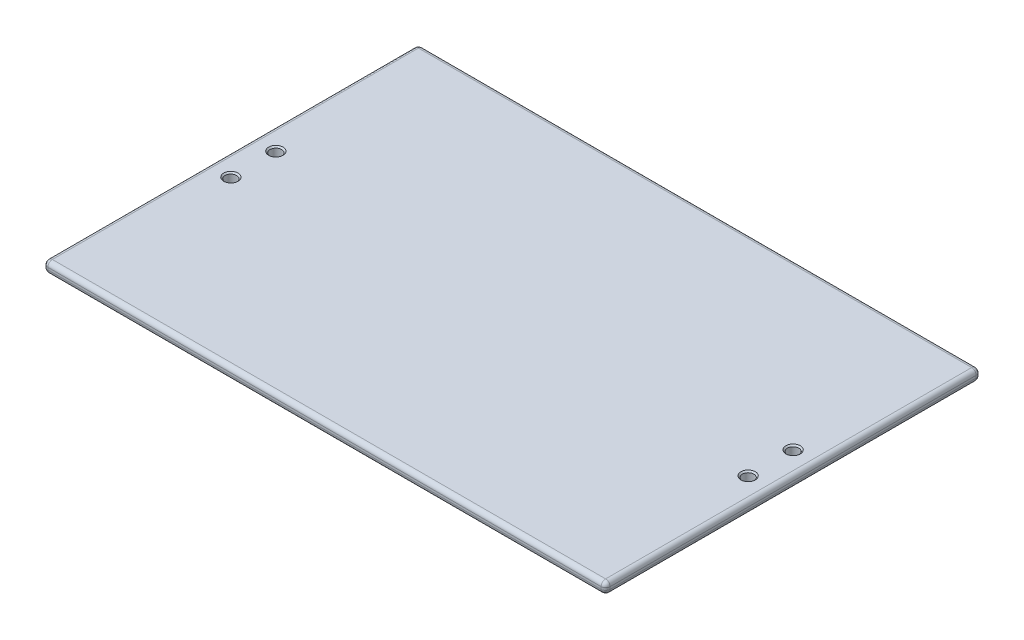
from build123d import *

# Parameters (mm, degrees)
SKETCH_1_W                     = 40
SKETCH_1_H                     = 66.7
EXTRUDE_1_DEPTH                = 2
SKETCH_2_W                     = 4
SKETCH_2_H                     = 66.7
EXTRUDE_2_DEPTH                = 100
CUT_EXTRUDE_1_DEPTH            = 115.526077816
CUT_EXTRUDE_1_DEPTH_BACK       = 115.526077816
HOLE_WIZARD_M4_1_D             = 3.3
HOLE_WIZARD_M4_1_CSINK_D       = 4.05
HOLE_WIZARD_M4_1_CSINK_ANGLE   = 90
HOLE_WIZARD_M4_2_AT_2_COUNT    = 2
HOLE_WIZARD_M4_2_AT_2_PITCH    = 68.59294731
HOLE_WIZARD_M4_2_AT_3_COUNT    = 2
HOLE_WIZARD_M4_2_AT_3_PITCH    = 26
HOLE_WIZARD_M4_2_AT_4_COUNT    = 2
HOLE_WIZARD_M4_2_AT_4_PITCH    = 62.376998966
HOLE_WIZARD_M4_2_AT_5_COUNT    = 2
HOLE_WIZARD_M4_2_AT_5_PITCH    = 56.7
SKETCH_11_W                    = 66.7
SKETCH_11_H                    = 2
EXTRUDE_3_DEPTH                = 100
SKETCH_13_W                    = 40
SKETCH_13_H                    = 66.7
EXTRUDE_4_DEPTH                = 2
SKETCH_14_W                    = 4
SKETCH_14_H                    = 66.7
EXTRUDE_5_DEPTH                = 100
CUT_EXTRUDE_2_DEPTH            = 180.589037806
CUT_EXTRUDE_2_DEPTH_BACK       = 180.589037806
HOLE_WIZARD_M4_3_AT_2_COUNT    = 2
HOLE_WIZARD_M4_3_AT_2_PITCH    = 26
HOLE_WIZARD_M4_3_AT_3_COUNT    = 2
HOLE_WIZARD_M4_3_AT_3_PITCH    = 62.376998966
HOLE_WIZARD_M4_3_AT_4_COUNT    = 2
HOLE_WIZARD_M4_3_AT_4_PITCH    = 56.7
CUT_EXTRUDE_3_REACH            = 181.589
SKETCH_18_R                    = 9.5
CUT_EXTRUDE_4_REACH            = 181.589
SKETCH_21_R                    = 11
CUT_EXTRUDE_5_REACH            = 181.589
SKETCH_22_R                    = 4.5
FILLET_1_R                     = 2
CUT_EXTRUDE_6_REACH            = 193.604
SKETCH_23_W                    = 36
SKETCH_23_H                    = 66.7
CUT_EXTRUDE_7_REACH            = 164.752
SKETCH_24_W                    = 36
SKETCH_24_H                    = 66.7
HOLE_WIZARD_M3_1_D             = 2.5
HOLE_WIZARD_M3_1_CSINK_D       = 3.05
HOLE_WIZARD_M3_1_CSINK_ANGLE   = 90
CUT_EXTRUDE_8_DEPTH            = 154.990981879
CUT_EXTRUDE_8_DEPTH_BACK       = 154.990981879
SKETCH_27_W                    = 4
SKETCH_27_H                    = 66.7
HOLE_WIZARD_M2_5_1_D           = 2.05
HOLE_WIZARD_M2_5_1_CSINK_D     = 2.55
HOLE_WIZARD_M2_5_1_CSINK_ANGLE = 90
FILLET_2_R                     = 0.8


with BuildPart() as part:
    # 草图1 → 凸台-拉伸1 (new body)
    with BuildSketch(Plane(origin=(0, 0, 0), x_dir=(1, 0, 0), z_dir=(0, 1, 0))):
        Rectangle(SKETCH_1_W, SKETCH_1_H)
    extrude(amount=EXTRUDE_1_DEPTH)

    # 草图2 → 凸台-拉伸2 (add)
    with BuildSketch(Plane(origin=(0, 2, 0), x_dir=(1, 0, 0), z_dir=(0, 1, 0))):
        with Locations((-18, 0)):
            Rectangle(SKETCH_2_W, SKETCH_2_H)
    extrude(amount=EXTRUDE_2_DEPTH)

    # 草图5 → 切除-拉伸1 (cut, two sides: drawn at the far end of the back side and taken through both)
    with BuildSketch(Plane.ZY.offset(20).offset(-CUT_EXTRUDE_1_DEPTH_BACK)):
        with BuildLine():
            ThreePointArc((0, 102), (23.582011153, 92.232011153), (33.35, 68.65))
            Line((33.35, 68.65), (33.35, 102))
            Line((33.35, 102), (0, 102))
        make_face()
        with BuildLine():
            ThreePointArc((-33.35, 68.65), (-23.582011153, 92.232011153), (0, 102))
            Line((0, 102), (-33.35, 102))
            Line((-33.35, 102), (-33.35, 68.65))
        make_face()
    extrude(amount=CUT_EXTRUDE_1_DEPTH + CUT_EXTRUDE_1_DEPTH_BACK, mode=Mode.SUBTRACT)

    # M4 螺纹孔1 (through all)
    with Locations(Plane.ZY.offset(20)):
        with Locations((0, 97.65), (25.11473671, 54.15), (-25.11473671, 54.15)):
            CounterSinkHole(HOLE_WIZARD_M4_1_D / 2, HOLE_WIZARD_M4_1_CSINK_D / 2, counter_sink_angle=HOLE_WIZARD_M4_1_CSINK_ANGLE)

    # 草图10 → M4 螺纹孔2 (revolve, cut)
    with BuildSketch(Plane(origin=(15, 2, -28.35), x_dir=(0, 0, 1), z_dir=(1, 0, 0))):
        Polygon((0, 0), (0, 2), (1.65, 2), (1.65, 0.375), (2.025, 0), align=None)
    hole_wizard_m4_2 = revolve(axis=Axis((15, 8.35, -28.35), (0, -1, 0)), mode=Mode.SUBTRACT)

    # M4 螺纹孔2 at 2: M4 螺纹孔2 ×2
    with Locations(*[Vector(-0.9508085645250022, 0, 0.3097790722852413) * (i * HOLE_WIZARD_M4_2_AT_2_PITCH) for i in range(1, HOLE_WIZARD_M4_2_AT_2_COUNT)]):
        add(hole_wizard_m4_2, mode=Mode.SUBTRACT)

    # M4 螺纹孔2 at 3: M4 螺纹孔2 ×2
    with Locations(*[(-i * HOLE_WIZARD_M4_2_AT_3_PITCH, 0, 0) for i in range(1, HOLE_WIZARD_M4_2_AT_3_COUNT)]):
        add(hole_wizard_m4_2, mode=Mode.SUBTRACT)

    # M4 螺纹孔2 at 4: M4 螺纹孔2 ×2
    with Locations(*[Vector(-0.4168203092647413, 0, 0.9089889052042635) * (i * HOLE_WIZARD_M4_2_AT_4_PITCH) for i in range(1, HOLE_WIZARD_M4_2_AT_4_COUNT)]):
        add(hole_wizard_m4_2, mode=Mode.SUBTRACT)

    # M4 螺纹孔2 at 5: M4 螺纹孔2 ×2
    with Locations(*[(0, 0, i * HOLE_WIZARD_M4_2_AT_5_PITCH) for i in range(1, HOLE_WIZARD_M4_2_AT_5_COUNT)]):
        add(hole_wizard_m4_2, mode=Mode.SUBTRACT)

    # 草图11 → 凸台-拉伸3 (add)
    with BuildSketch(Plane.ZY.offset(20)):
        with Locations((0, 16)):
            Rectangle(SKETCH_11_W, SKETCH_11_H)
    extrude(amount=EXTRUDE_3_DEPTH)



with BuildPart() as body_2:
    # 草图13 → 凸台-拉伸4 (new body)
    with BuildSketch(Plane(origin=(0, 0, 0), x_dir=(1, 0, 0), z_dir=(0, 1, 0))):
        with Locations((-140, 0)):
            Rectangle(SKETCH_13_W, SKETCH_13_H)
    extrude(amount=EXTRUDE_4_DEPTH)


with BuildPart() as part_1:
    add(part.part)

    add(body_2.part)  # 凸台-拉伸5 merges body 2
    # 草图14 → 凸台-拉伸5 (add)
    with BuildSketch(Plane(origin=(0, 2, 0), x_dir=(1, 0, 0), z_dir=(0, 1, 0))):
        with Locations((-122, 0)):
            Rectangle(SKETCH_14_W, SKETCH_14_H)
    extrude(amount=EXTRUDE_5_DEPTH)

    # 草图15 → 切除-拉伸2 (cut, two sides: drawn at the far end of the back side and taken through both)
    with BuildSketch(Plane.ZY.offset(124).offset(-CUT_EXTRUDE_2_DEPTH_BACK)):
        with BuildLine():
            ThreePointArc((0, 102), (23.582011153, 92.232011153), (33.35, 68.65))
            Line((33.35, 68.65), (33.35, 102))
            Line((33.35, 102), (0, 102))
        make_face()
        with BuildLine():
            ThreePointArc((-33.35, 68.65), (-23.582011153, 92.232011153), (0, 102))
            Line((0, 102), (-33.35, 102))
            Line((-33.35, 102), (-33.35, 68.65))
        make_face()
    extrude(amount=CUT_EXTRUDE_2_DEPTH + CUT_EXTRUDE_2_DEPTH_BACK, mode=Mode.SUBTRACT)

    # 草图17 → M4 螺纹孔3 (revolve, cut)
    with BuildSketch(Plane(origin=(-129, 2, -28.35), x_dir=(0, 0, 1), z_dir=(1, 0, 0))):
        Polygon((0, 0), (0, 2), (1.65, 2), (1.65, 0.375), (2.025, 0), align=None)
    hole_wizard_m4_3 = revolve(axis=Axis((-129, 8.35, -28.35), (0, -1, 0)), mode=Mode.SUBTRACT)

    # M4 螺纹孔3 at 2: M4 螺纹孔3 ×2
    with Locations(*[(-i * HOLE_WIZARD_M4_3_AT_2_PITCH, 0, 0) for i in range(1, HOLE_WIZARD_M4_3_AT_2_COUNT)]):
        add(hole_wizard_m4_3, mode=Mode.SUBTRACT)

    # M4 螺纹孔3 at 3: M4 螺纹孔3 ×2
    with Locations(*[Vector(-0.41682030926474106, 0, 0.9089889052042636) * (i * HOLE_WIZARD_M4_3_AT_3_PITCH) for i in range(1, HOLE_WIZARD_M4_3_AT_3_COUNT)]):
        add(hole_wizard_m4_3, mode=Mode.SUBTRACT)

    # M4 螺纹孔3 at 4: M4 螺纹孔3 ×2
    with Locations(*[(0, 0, i * HOLE_WIZARD_M4_3_AT_4_PITCH) for i in range(1, HOLE_WIZARD_M4_3_AT_4_COUNT)]):
        add(hole_wizard_m4_3, mode=Mode.SUBTRACT)

    # 草图18 → 切除-拉伸3 (cut, up to next)
    with BuildSketch(Plane.ZY.offset(124), mode=Mode.PRIVATE) as cut_extrude_3_sk1:
        with Locations((0, 68.65)):
            Circle(SKETCH_18_R)
    cut_extrude_3_tool1 = extrude(cut_extrude_3_sk1.sketch, amount=-CUT_EXTRUDE_3_REACH, mode=Mode.PRIVATE) & part_1.part
    add(cut_extrude_3_tool1.solids().sort_by_distance((-124, 68.65, 0))[0], mode=Mode.SUBTRACT)

    # 草图21 → 切除-拉伸4 (cut, up to next)
    with BuildSketch(Plane(origin=(-16, 0, 0), x_dir=(0, 0, -1), z_dir=(1, 0, 0)), mode=Mode.PRIVATE) as cut_extrude_4_sk1:
        with Locations((0, 68.65)):
            Circle(SKETCH_21_R)
    cut_extrude_4_tool1 = extrude(cut_extrude_4_sk1.sketch, amount=-CUT_EXTRUDE_4_REACH, mode=Mode.PRIVATE) & part_1.part
    add(cut_extrude_4_tool1.solids().sort_by_distance((-16, 68.65, 0))[0], mode=Mode.SUBTRACT)

    # 草图22 → 切除-拉伸5 (cut, up to next)
    with BuildSketch(Plane(origin=(-16, 0, 0), x_dir=(0, 0, -1), z_dir=(1, 0, 0)), mode=Mode.PRIVATE) as cut_extrude_5_sk1:
        with Locations((16.670989023, 59.025)):
            Circle(SKETCH_22_R)
    cut_extrude_5_tool1 = extrude(cut_extrude_5_sk1.sketch, amount=-CUT_EXTRUDE_5_REACH, mode=Mode.PRIVATE) & part_1.part
    add(cut_extrude_5_tool1.solids().sort_by_distance((-16, 59.025, -16.670989))[0], mode=Mode.SUBTRACT)

    # 圆角1
    fillet_1_edges = [part_1.edges().sort_by_distance(p)[0] for p in [
        (20, 1, -33.35),
        (20, 1, 33.35),
        (-160, 1, 33.35),
        (-160, 1, -33.35),
    ]]
    fillet(fillet_1_edges, radius=FILLET_1_R)

    # 草图23 → 切除-拉伸6 (cut, up to next)
    with BuildSketch(Plane(origin=(0, 2, 0), x_dir=(1, 0, 0), z_dir=(0, 1, 0)), mode=Mode.PRIVATE) as cut_extrude_6_sk1:
        with Locations((-142, 0)):
            Rectangle(SKETCH_23_W, SKETCH_23_H)
    cut_extrude_6_tool1 = extrude(cut_extrude_6_sk1.sketch, amount=-CUT_EXTRUDE_6_REACH, mode=Mode.PRIVATE) & part_1.part
    add(cut_extrude_6_tool1.solids().sort_by_distance((-142, 2, 0))[0], mode=Mode.SUBTRACT)

    # 草图24 → 切除-拉伸7 (cut, up to next)
    with BuildSketch(Plane(origin=(0, 2, 0), x_dir=(1, 0, 0), z_dir=(0, 1, 0)), mode=Mode.PRIVATE) as cut_extrude_7_sk1:
        with Locations((2, 0)):
            Rectangle(SKETCH_24_W, SKETCH_24_H)
    cut_extrude_7_tool1 = extrude(cut_extrude_7_sk1.sketch, amount=-CUT_EXTRUDE_7_REACH, mode=Mode.PRIVATE) & part_1.part
    add(cut_extrude_7_tool1.solids().sort_by_distance((2, 2, 0))[0], mode=Mode.SUBTRACT)

    # M3 螺纹孔1 (through all)
    with Locations(Plane(origin=(-16, 0, 0), x_dir=(0, 0, -1), z_dir=(1, 0, 0))):
        with Locations((9, 6), (-9, 6)):
            CounterSinkHole(HOLE_WIZARD_M3_1_D / 2, HOLE_WIZARD_M3_1_CSINK_D / 2, counter_sink_angle=HOLE_WIZARD_M3_1_CSINK_ANGLE)

    # 草图27 → 切除-拉伸8 (cut, two sides: drawn at the far end of the back side and taken through both)
    with BuildSketch(Plane(origin=(0, 17, 0), x_dir=(1, 0, 0), z_dir=(0, 1, 0)).offset(-CUT_EXTRUDE_8_DEPTH_BACK)):
        with Locations((-122, 0)):
            Rectangle(SKETCH_27_W, SKETCH_27_H)
        with Locations((-18, 0)):
            Rectangle(SKETCH_27_W, SKETCH_27_H)
    extrude(amount=CUT_EXTRUDE_8_DEPTH + CUT_EXTRUDE_8_DEPTH_BACK, mode=Mode.SUBTRACT)

    # M2.5 螺纹孔1 (through all)
    with Locations(Plane(origin=(0, 17, 0), x_dir=(1, 0, 0), z_dir=(0, 1, 0))):
        with Locations((-116, 4), (-116, -4), (-24, 4), (-24, -4)):
            CounterSinkHole(HOLE_WIZARD_M2_5_1_D / 2, HOLE_WIZARD_M2_5_1_CSINK_D / 2, counter_sink_angle=HOLE_WIZARD_M2_5_1_CSINK_ANGLE)

    # 圆角2
    fillet_2_edges = [part_1.edges().sort_by_distance(p)[0] for p in [
        (-70, 15, 33.35),
        (-70, 17, 33.35),
        (-20, 15, 0),
        (-20, 16, 33.35),
        (-20, 17, 0),
        (-20, 16, -33.35),
        (-70, 17, -33.35),
        (-70, 15, -33.35),
        (-120, 15, 0),
        (-120, 16, -33.35),
        (-120, 17, 0),
        (-120, 16, 33.35),
    ]]
    fillet(fillet_2_edges, radius=FILLET_2_R)


solid = part_1.part
